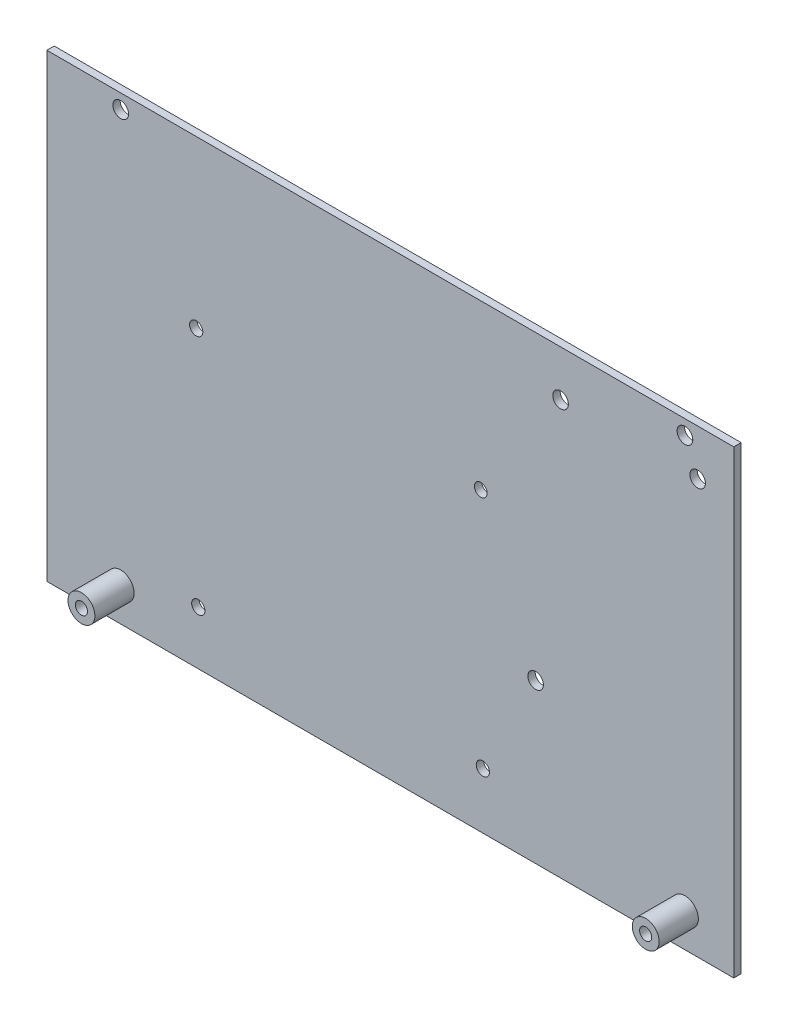
from build123d import *

# Parameters (mm, degrees)
SKETCH1_W           = 140
SKETCH1_H           = 93.753760253
BOSS_EXTRUDE1_DEPTH = 1.5
SKETCH2_R           = 1.6
CUT_EXTRUDE1_DEPTH  = 1.5
SKETCH3_R           = 2.737611944
SKETCH3_R_2         = 1.237611944
BOSS_EXTRUDE2_DEPTH = 8
SKETCH4_R           = 1.3
SKETCH4_R_2         = 1.35
SKETCH4_R_3         = 1.5875
CUT_EXTRUDE2_DEPTH  = 8


with BuildPart() as part:
    # Sketch1 → Boss-Extrude1 (new body)
    with BuildSketch(Plane.XY):
        with Locations((102, 196.095777869)):
            Rectangle(SKETCH1_W, SKETCH1_H)
    extrude(amount=BOSS_EXTRUDE1_DEPTH)

    # Sketch2 → Cut-Extrude1 (cut)
    with BuildSketch(Plane.XY.offset(1.5)):
        with Locations((47.04400772, 240.027868216)):
            Circle(SKETCH2_R)
        with Locations((162.04400772, 240.027868216)):
            Circle(SKETCH2_R)
    extrude(amount=-CUT_EXTRUDE1_DEPTH, mode=Mode.SUBTRACT)

    # Sketch3 → Boss-Extrude2 (add)
    # profile 1 of 2: a face of its own
    with BuildSketch(Plane.XY.offset(1.5)):
        with Locations((47.04400772, 156.027868216)):
            Circle(SKETCH3_R)
        with Locations((47.04400772, 156.027868216)):
            Circle(SKETCH3_R_2, mode=Mode.SUBTRACT)
    # profile 2 of 2: a face of its own
    with BuildSketch(Plane.XY.offset(1.5)):
        with Locations((162.04400772, 156.027868216)):
            Circle(SKETCH3_R)
        with Locations((162.04400772, 156.027868216)):
            Circle(SKETCH3_R_2, mode=Mode.SUBTRACT)
    extrude(amount=BOSS_EXTRUDE2_DEPTH)

    # Sketch4 → Cut-Extrude2 (cut)
    with BuildSketch(Plane(origin=(0, 0, 0), x_dir=(-1, 0, 0), z_dir=(0, 0, -1))):
        with Locations((-120.431826709, 209.617216317)):
            Circle(SKETCH4_R)
        with Locations((-62.434035172, 209.111077258)):
            Circle(SKETCH4_R_2)
        with Locations((-62.861635411, 160.112943028)):
            Circle(SKETCH4_R_2)
        with Locations((-120.859426949, 160.619082087)):
            Circle(SKETCH4_R_2)
        with Locations((-131.613133958, 181.551872542)):
            Circle(SKETCH4_R_3)
        with Locations((-136.693133958, 233.621872542)):
            Circle(SKETCH4_R_3)
        with Locations((-164.633133958, 233.621872542)):
            Circle(SKETCH4_R_3)
    extrude(amount=-CUT_EXTRUDE2_DEPTH, mode=Mode.SUBTRACT)


solid = part.part
